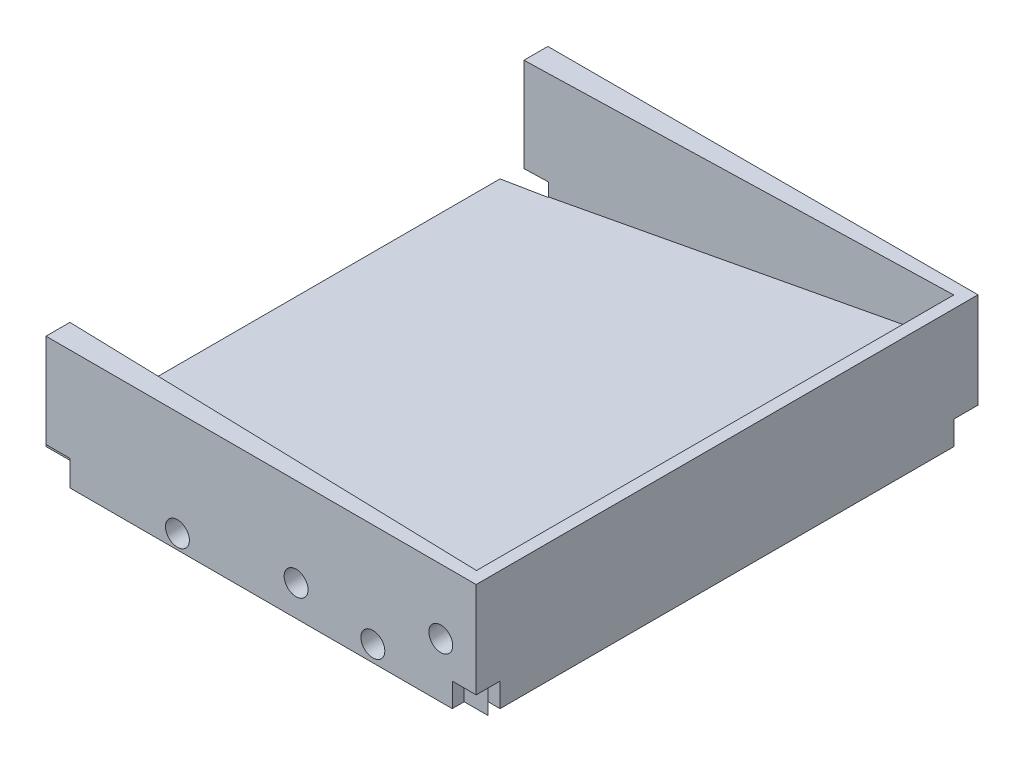
from build123d import *

# Parameters (mm, degrees)
ESQUISSE1_R             = 3
BOSS_EXTRU_1_DEPTH      = 200
ESQUISSE4_W             = 5
ESQUISSE4_H             = 50
BOSS_EXTRU_4_DEPTH      = 180
BOSS_EXTRU_7_DEPTH      = 50
ESQUISSE6_W             = 20
ESQUISSE6_H             = 10.719834163
ENL_V_MAT_EXTRU_2_DEPTH = 10
ESQUISSE5_W             = 10
ESQUISSE5_H             = 10
ENL_V_MAT_EXTRU_1_DEPTH = 10
ESQUISSE14_R            = 5
ENL_V_MAT_EXTRU_4_DEPTH = 15
BOSS_EXTRU_8_REACH      = 242.401


with BuildPart() as part:
    # Esquisse1 → Boss.-Extru.1 (new body)
    with BuildSketch(Plane.XY):
        Polygon((-105.796013405, 0), (84.203986595, 0), (84.203986595, 33.502126335), (-105.796013405, 2), align=None)
        with Locations((69.406004871, 22.939397164)):
            Circle(ESQUISSE1_R, mode=Mode.SUBTRACT)
        with Locations((40.981469067, 6.77616521)):
            Circle(ESQUISSE1_R, mode=Mode.SUBTRACT)
        with Locations((-40.796013405, 6)):
            Circle(ESQUISSE1_R, mode=Mode.SUBTRACT)
        with Locations((8.861542866, 12.901085106)):
            Circle(ESQUISSE1_R, mode=Mode.SUBTRACT)
    extrude(amount=BOSS_EXTRU_1_DEPTH)

    # Esquisse4 → Boss.-Extru.4 (add)
    with BuildSketch(Plane(origin=(84.203986595, 0, 0), x_dir=(0, 0, -1), z_dir=(1, 0, 0))):
        with Locations((-202.5, 25)):
            Rectangle(ESQUISSE4_W, ESQUISSE4_H)
        with Locations((2.5, 25)):
            Rectangle(ESQUISSE4_W, ESQUISSE4_H)
    extrude(amount=-BOSS_EXTRU_4_DEPTH)

    # Esquisse8 → Boss.-Extru.7 (add)
    with BuildSketch(Plane(origin=(0, 50, 0), x_dir=(1, 0, 0), z_dir=(0, 1, 0))):
        Polygon((84.203986595, 0), (-95.796013405, 0), (-95.796013405, -5), align=None)
    boss_extru_7 = extrude(amount=-BOSS_EXTRU_7_DEPTH)

    # Esquisse6 → Enlèv. mat.-Extru.2 (cut)
    with BuildSketch(Plane(origin=(0, 0, -5), x_dir=(-1, 0, 0), z_dir=(0, 0, -1))):
        with Locations((95.796013405, 5.359917081)):
            Rectangle(ESQUISSE6_W, ESQUISSE6_H)
    enl_v_mat_extru_2 = extrude(amount=-ENL_V_MAT_EXTRU_2_DEPTH, mode=Mode.SUBTRACT)

    # Esquisse5 → Enlèv. mat.-Extru.1 (cut)
    with BuildSketch(Plane(origin=(84.203986595, 0, 0), x_dir=(0, 0, -1), z_dir=(1, 0, 0))):
        with Locations((-200, 5)):
            Rectangle(ESQUISSE5_W, ESQUISSE5_H)
        with Locations((0, 5)):
            Rectangle(ESQUISSE5_W, ESQUISSE5_H)
    extrude(amount=-ENL_V_MAT_EXTRU_1_DEPTH, mode=Mode.SUBTRACT)

    # Esquisse14 → Enlèv. mat.-Extru.4 (cut)
    with BuildSketch(Plane(origin=(0, 0, -5), x_dir=(-1, 0, 0), z_dir=(0, 0, -1))):
        with Locations((-69.406004871, 22.939397164)):
            Circle(ESQUISSE14_R)
        with Locations((-40.981469067, 6.77616521)):
            Circle(ESQUISSE14_R)
        with Locations((-8.861542866, 12.901085106)):
            Circle(ESQUISSE14_R)
        with Locations((40.796013405, 6)):
            Circle(ESQUISSE14_R)
    enl_v_mat_extru_4 = extrude(amount=-ENL_V_MAT_EXTRU_4_DEPTH, mode=Mode.SUBTRACT)

    # Symétrie3: Boss.-Extru.7, Enlèv. mat.-Extru.2, Enlèv. mat.-Extru.4 across plane
    add(boss_extru_7.mirror(Plane(origin=(0, 0, 100), x_dir=(1, 0, 0), z_dir=(0, 0, -1))))
    add(enl_v_mat_extru_2.mirror(Plane(origin=(0, 0, 100), x_dir=(1, 0, 0), z_dir=(0, 0, -1))), mode=Mode.SUBTRACT)
    add(enl_v_mat_extru_4.mirror(Plane(origin=(0, 0, 100), x_dir=(1, 0, 0), z_dir=(0, 0, -1))), mode=Mode.SUBTRACT)

    # Boss.-Extru.8: up to this plane
    boss_extru_8_end = Plane(origin=(-95.796013405, -180.069431054, 195), z_dir=(-0.0277670672403533, 0, 0.9996144206527183))
    # Esquisse15 → Boss.-Extru.8 (add, up to the surface)
    with BuildSketch(Plane(origin=(0, 0, -5), x_dir=(-1, 0, 0), z_dir=(0, 0, -1)), mode=Mode.PRIVATE) as boss_extru_8_sk1:
        Polygon((-84.203986595, 33.502126335), (-79.203986595, 32.67312301), (-79.203986595, 50), (-84.203986595, 50), align=None)
    boss_extru_8_tool1 = split(extrude(boss_extru_8_sk1.sketch, amount=-BOSS_EXTRU_8_REACH, mode=Mode.PRIVATE), bisect_by=boss_extru_8_end, keep=Keep.BOTH, mode=Mode.PRIVATE)
    add(boss_extru_8_tool1.solids().sort_by_distance((81.683563, 41.542119, -5))[0])


solid = part.part
